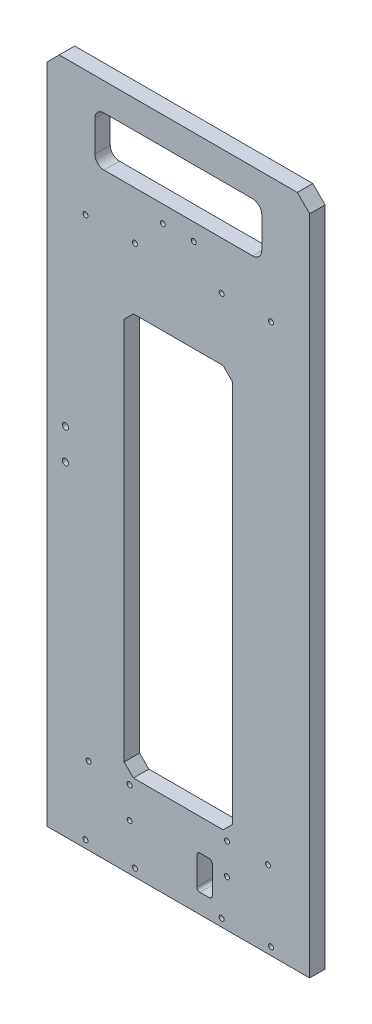
from build123d import *

# Parameters (mm, degrees)
MODEL_R             = 1.6
MODEL_R_2           = 2
BOSS_EXTRUDE1_DEPTH = 10


with BuildPart() as part:
    # Model → Boss-Extrude1 (new body)
    with BuildSketch(Plane.XY):
        Polygon((85, 428), (85, 0), (-85, 0), (-85, 428), (-77, 436), (77, 436), align=None)
        with Locations((-31.5, 50)):
            Circle(MODEL_R, mode=Mode.SUBTRACT)
        with Locations((-31.5, 30)):
            Circle(MODEL_R, mode=Mode.SUBTRACT)
        with Locations((31.5, 30)):
            Circle(MODEL_R, mode=Mode.SUBTRACT)
        with Locations((31.5, 50)):
            Circle(MODEL_R, mode=Mode.SUBTRACT)
        with Locations((-58, 50)):
            Circle(MODEL_R, mode=Mode.SUBTRACT)
        with Locations((-73, 210)):
            Circle(MODEL_R_2, mode=Mode.SUBTRACT)
        with Locations((-73, 230)):
            Circle(MODEL_R_2, mode=Mode.SUBTRACT)
        with Locations((60, 355)):
            Circle(MODEL_R, mode=Mode.SUBTRACT)
        with Locations((58, 50)):
            Circle(MODEL_R, mode=Mode.SUBTRACT)
        with Locations((-60, 355)):
            Circle(MODEL_R, mode=Mode.SUBTRACT)
        with Locations((-28, 355)):
            Circle(MODEL_R, mode=Mode.SUBTRACT)
        with Locations((28, 355)):
            Circle(MODEL_R, mode=Mode.SUBTRACT)
        with Locations((60, 5)):
            Circle(MODEL_R, mode=Mode.SUBTRACT)
        with Locations((28, 5)):
            Circle(MODEL_R, mode=Mode.SUBTRACT)
        with Locations((-28, 5)):
            Circle(MODEL_R, mode=Mode.SUBTRACT)
        with Locations((-60, 5)):
            Circle(MODEL_R, mode=Mode.SUBTRACT)
        with Locations((10, 375)):
            Circle(MODEL_R, mode=Mode.SUBTRACT)
        with Locations((-10, 375)):
            Circle(MODEL_R, mode=Mode.SUBTRACT)
        with BuildLine():
            Line((14, 34.5), (20, 34.5))
            ThreePointArc((20, 34.5), (21.414213562, 33.914213562), (22, 32.5))
            Line((22, 32.5), (22, 14.5))
            ThreePointArc((22, 14.5), (21.414213562, 13.085786438), (20, 12.5))
            Line((20, 12.5), (14, 12.5))
            ThreePointArc((14, 12.5), (12.585786438, 13.085786438), (12, 14.5))
            Line((12, 14.5), (12, 32.5))
            ThreePointArc((12, 32.5), (12.585786438, 33.914213562), (14, 34.5))
        make_face(mode=Mode.SUBTRACT)
        Polygon((-29, 315), (29, 315), (35, 309), (35, 61), (29, 55), (-29, 55), (-35, 61), (-35, 309), align=None, mode=Mode.SUBTRACT)
        with BuildLine():
            Line((-54, 392), (-54, 412))
            ThreePointArc((-54, 412), (-52.242640687, 416.242640687), (-48, 418))
            Line((-48, 418), (48, 418))
            ThreePointArc((48, 418), (52.242640687, 416.242640687), (54, 412))
            Line((54, 412), (54, 392))
            ThreePointArc((54, 392), (52.242640687, 387.757359313), (48, 386))
            Line((48, 386), (-48, 386))
            ThreePointArc((-48, 386), (-52.242640687, 387.757359313), (-54, 392))
        make_face(mode=Mode.SUBTRACT)
    extrude(amount=BOSS_EXTRUDE1_DEPTH)


solid = part.part
